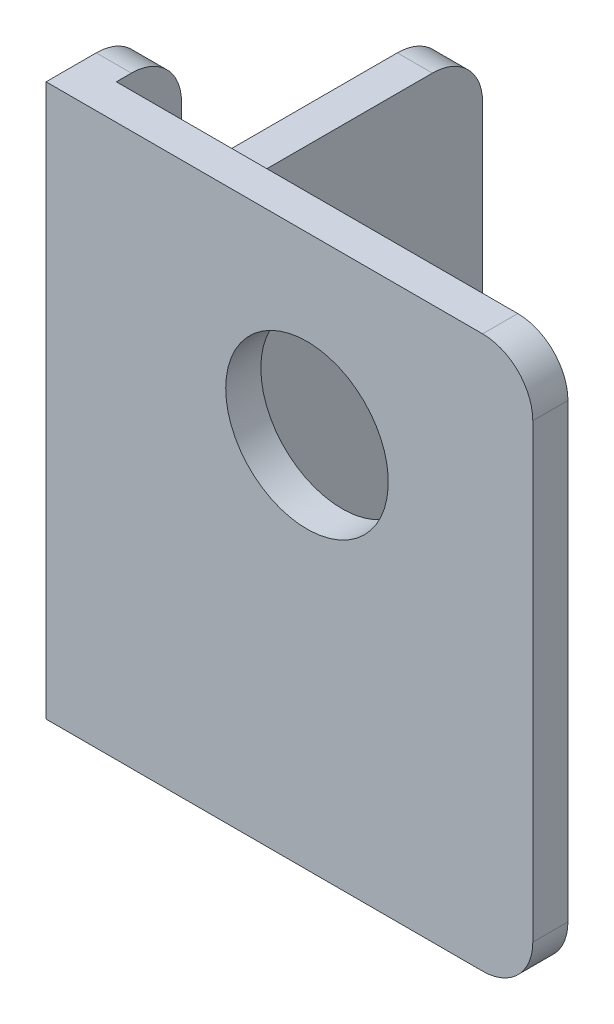
from build123d import *

# Parameters (mm, degrees)
BOSS_EXTRUDE1_DEPTH  = 27.5
SKETCH4_R            = 8.1
CUT_EXTRUDE1_DEPTH   = 67.638952573
M5_CLEARANCE_HOLE1_D = 5.5
SKETCH7_W            = 30
SKETCH7_H            = 15
CUT_EXTRUDE2_DEPTH   = 67.191011474
FILLET1_R            = 5


with BuildPart() as part:
    # Sketch1 → Boss-Extrude1 (new, symmetric)
    with BuildSketch(Plane(origin=(0, 0, 0), x_dir=(1, 0, 0), z_dir=(0, 1, 0))):
        Polygon((0, 0), (0, 40), (3.5, 40), (3.5, 3.5), (48.5, 3.5), (48.5, 0), align=None)
    extrude(amount=BOSS_EXTRUDE1_DEPTH, both=True)

    # Sketch4 → Cut-Extrude1 (cut, through all)
    with BuildSketch(Plane(origin=(0, 0, -3.5), x_dir=(-1, 0, 0), z_dir=(0, 0, -1))):
        with Locations((-26, 10)):
            Circle(SKETCH4_R)
    extrude(amount=-CUT_EXTRUDE1_DEPTH, mode=Mode.SUBTRACT)

    # M5 Clearance Hole1 (through all)
    with Locations(Plane.ZY):
        with Locations((-10.5, -17.5), (-33, -17.5)):
            Hole(M5_CLEARANCE_HOLE1_D / 2)

    # Sketch7 → Cut-Extrude2 (cut, through all)
    with BuildSketch(Plane(origin=(3.5, 0, 0), x_dir=(0, 0, -1), z_dir=(1, 0, 0))):
        with Locations((25, 20)):
            Rectangle(SKETCH7_W, SKETCH7_H)
    extrude(amount=-CUT_EXTRUDE2_DEPTH, mode=Mode.SUBTRACT)

    # Fillet1
    fillet1_edges = [part.edges().sort_by_distance(p)[0] for p in [
        (1.75, 12.5, -40),
        (1.75, 12.5, -10),
        (1.75, 27.5, -10),
        (1.75, -27.5, -40),
        (48.5, -27.5, -1.75),
        (48.5, 27.5, -1.75),
    ]]
    fillet(fillet1_edges, radius=FILLET1_R)


solid = part.part
